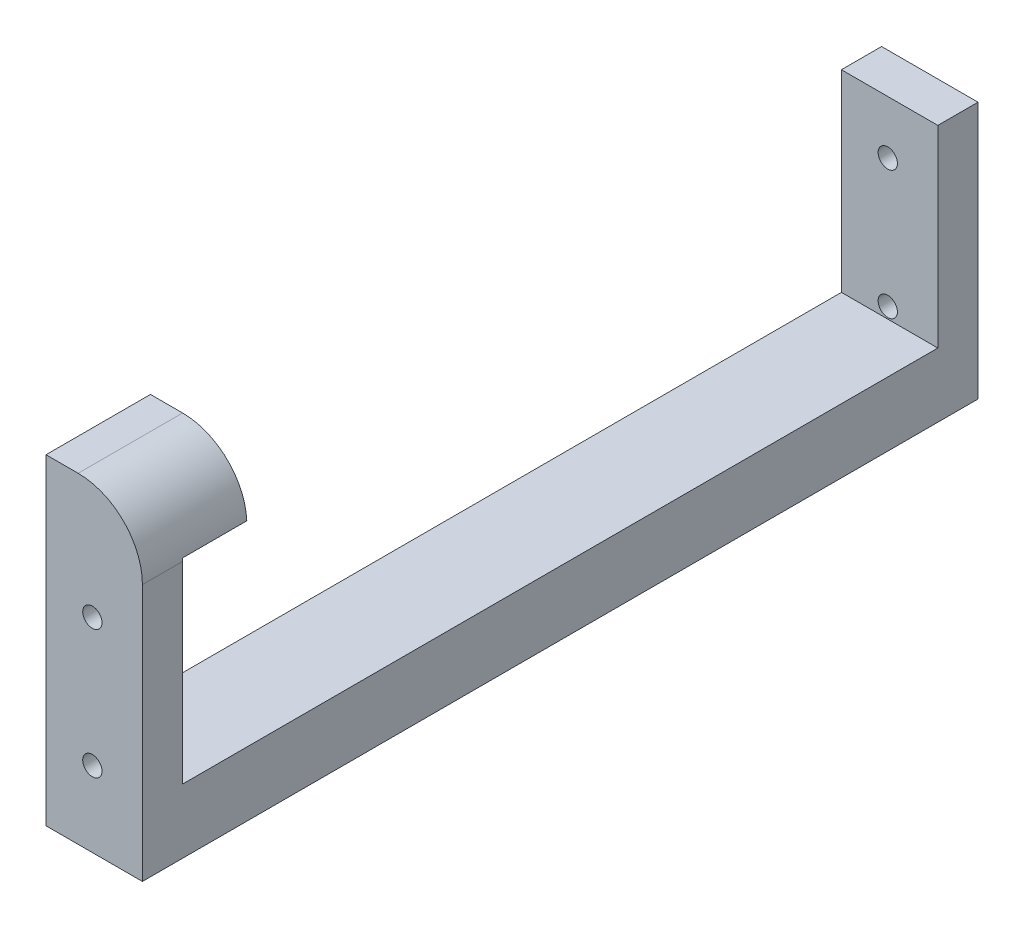
from build123d import *

# Parameters (mm, degrees)
SKETCH1_W               = 15
SKETCH1_H               = 40
BOSS_EXTRUDE1_DEPTH     = 130
SKETCH2_W               = 15
SKETCH2_H               = 117.5
CUT_EXTRUDE1_DEPTH      = 30
CUT_EXTRUDE2_DEPTH      = 133.594306062
CUT_EXTRUDE2_DEPTH_BACK = 133.594306062
SKETCH3_R               = 1.5
SKETCH4_W               = 15
SKETCH4_H               = 6.25
BOSS_EXTRUDE2_DEPTH     = 10
SKETCH5_W               = 15
SKETCH5_H               = 9.54020797
BOSS_EXTRUDE3_DEPTH     = 10
FILLET1_R               = 10
SKETCH7_W               = 15
SKETCH7_H               = 6.25
CUT_EXTRUDE3_DEPTH      = 10


with BuildPart() as part:
    # Sketch1 → Boss-Extrude1 (new body)
    with BuildSketch(Plane.XY):
        with Locations((0, 5)):
            Rectangle(SKETCH1_W, SKETCH1_H)
    extrude(amount=BOSS_EXTRUDE1_DEPTH)

    # Sketch2 → Cut-Extrude1 (cut)
    with BuildSketch(Plane(origin=(0, 25, 0), x_dir=(1, 0, 0), z_dir=(0, 1, 0))):
        with Locations((0, -65)):
            Rectangle(SKETCH2_W, SKETCH2_H)
    extrude(amount=-CUT_EXTRUDE1_DEPTH, mode=Mode.SUBTRACT)

    # Sketch3 → Cut-Extrude2 (cut, two sides: drawn at the far end of the back side and taken through both)
    with BuildSketch(Plane(origin=(0, 0, 0), x_dir=(-1, 0, 0), z_dir=(0, 0, -1)).offset(-CUT_EXTRUDE2_DEPTH_BACK)):
        with Locations((0.28935703, 16.716588701)):
            Circle(SKETCH3_R)
        with Locations((0.28935703, -3.283411299)):
            Circle(SKETCH3_R)
    extrude(amount=CUT_EXTRUDE2_DEPTH + CUT_EXTRUDE2_DEPTH_BACK, mode=Mode.SUBTRACT)

    # Sketch4 → Boss-Extrude2 (add)
    with BuildSketch(Plane(origin=(0, 25, 0), x_dir=(1, 0, 0), z_dir=(0, 1, 0))):
        with Locations((0, -3.125)):
            Rectangle(SKETCH4_W, SKETCH4_H)
        with Locations((0, -126.875)):
            Rectangle(SKETCH4_W, SKETCH4_H)
    extrude(amount=BOSS_EXTRUDE2_DEPTH)

    # Sketch5 → Boss-Extrude3 (add)
    with BuildSketch(Plane(origin=(0, 0, 123.75), x_dir=(-1, 0, 0), z_dir=(0, 0, -1))):
        with Locations((0, 30.229896015)):
            Rectangle(SKETCH5_W, SKETCH5_H)
    extrude(amount=BOSS_EXTRUDE3_DEPTH)

    # Fillet1
    fillet1_edges = [part.edges().sort_by_distance(p)[0] for p in [
        (7.5, 35, 3.125),
        (7.5, 35, 121.875),
    ]]
    fillet(fillet1_edges, radius=FILLET1_R)

    # Sketch7 → Cut-Extrude3 (cut)
    with BuildSketch(Plane(origin=(0, 35, 0), x_dir=(1, 0, 0), z_dir=(0, 1, 0))):
        with Locations((0, -3.125)):
            Rectangle(SKETCH7_W, SKETCH7_H)
    extrude(amount=-CUT_EXTRUDE3_DEPTH, mode=Mode.SUBTRACT)


solid = part.part
